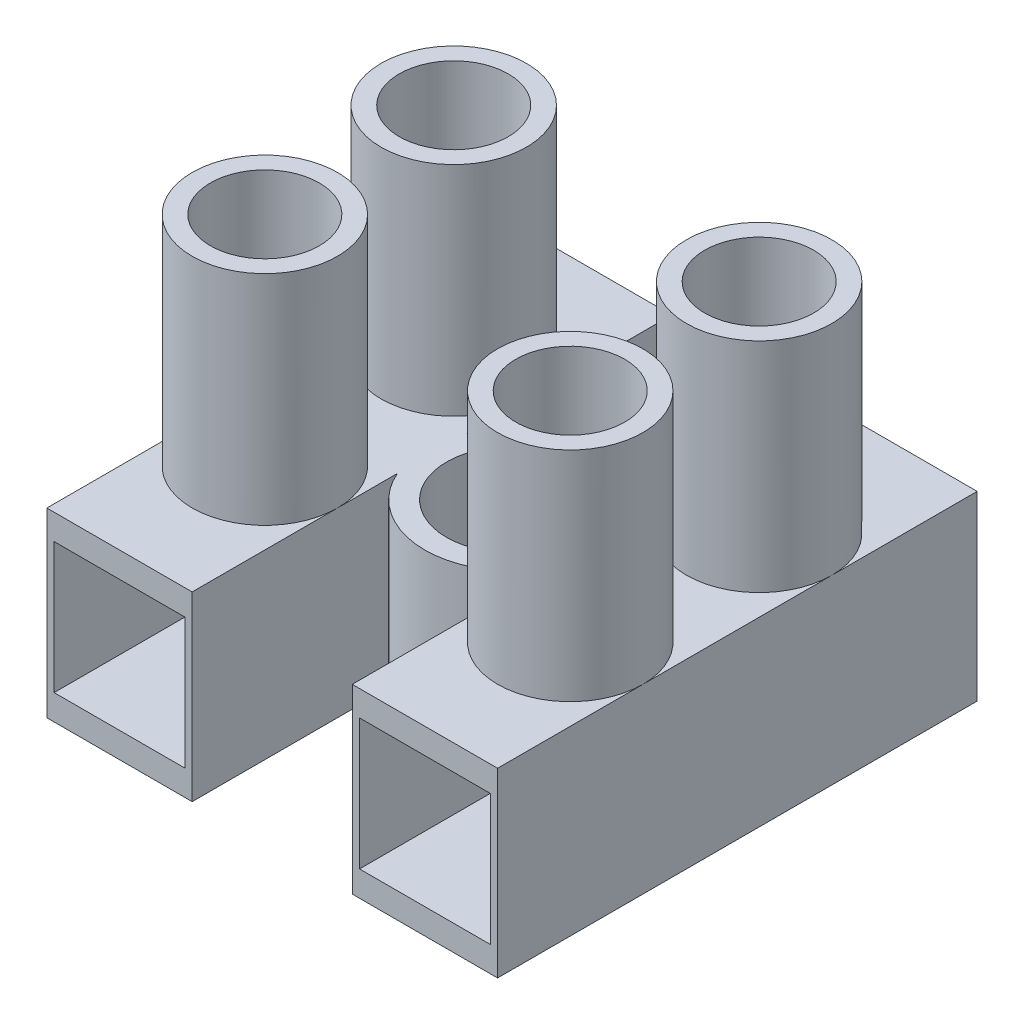
from build123d import *

# Parameters (mm, degrees)
BOSS_EXTRUDE1_DEPTH = 6.35
SKETCH2_R           = 2.286
CUT_EXTRUDE1_DEPTH  = 14.139417841
SKETCH3_W           = 4.572
SKETCH3_H           = 4.572
CUT_EXTRUDE2_DEPTH  = 7.62
SKETCH4_W           = 4.572
SKETCH4_H           = 4.572
CUT_EXTRUDE3_DEPTH  = 7.62
SKETCH5_R           = 2.54
SKETCH5_R_2         = 1.905
BOSS_EXTRUDE2_DEPTH = 7.62


with BuildPart() as part:
    # Sketch1 → Boss-Extrude1 (new body)
    with BuildSketch(Plane(origin=(0, 0, 0), x_dir=(1, 0, 0), z_dir=(0, 1, 0))):
        with BuildLine():
            Line((-2.798063036, -1.208779237), (-2.798063036, -8.382))
            Line((-2.798063036, -8.382), (-7.878063036, -8.382))
            Line((-7.878063036, -8.382), (-7.878063036, 8.382))
            Line((-7.878063036, 8.382), (-2.798063036, 8.382))
            Line((-2.798063036, 8.382), (-2.798063036, 1.208779237))
            ThreePointArc((-2.798063036, 1.208779237), (0, 3.048), (2.798063036, 1.208779237))
            Line((2.798063036, 1.208779237), (2.798063036, 8.382))
            Line((2.798063036, 8.382), (7.878063036, 8.382))
            Line((7.878063036, 8.382), (7.878063036, -8.382))
            Line((7.878063036, -8.382), (2.798063036, -8.382))
            Line((2.798063036, -8.382), (2.798063036, -1.208779237))
            ThreePointArc((2.798063036, -1.208779237), (0, -3.048), (-2.798063036, -1.208779237))
        make_face()
    extrude(amount=-BOSS_EXTRUDE1_DEPTH)

    # Sketch2 → Cut-Extrude1 (cut, through all)
    with BuildSketch(Plane(origin=(0, 0, 0), x_dir=(1, 0, 0), z_dir=(0, 1, 0))):
        with Locations(Location((0, 0, 0), (0, 0, 270))):
            Circle(SKETCH2_R)
    extrude(amount=-CUT_EXTRUDE1_DEPTH, mode=Mode.SUBTRACT)

    # Sketch3 → Cut-Extrude2 (cut)
    with BuildSketch(Plane.XY.offset(8.382)):
        with Locations((-5.338063036, -3.175)):
            Rectangle(SKETCH3_W, SKETCH3_H)
        with Locations((5.338063036, -3.175)):
            Rectangle(SKETCH3_W, SKETCH3_H)
    extrude(amount=-CUT_EXTRUDE2_DEPTH, mode=Mode.SUBTRACT)

    # Sketch4 → Cut-Extrude3 (cut)
    with BuildSketch(Plane(origin=(0, 0, -8.382), x_dir=(-1, 0, 0), z_dir=(0, 0, -1))):
        with Locations((-5.338063036, -3.175)):
            Rectangle(SKETCH4_W, SKETCH4_H)
        with Locations((5.338063036, -3.175)):
            Rectangle(SKETCH4_W, SKETCH4_H)
    extrude(amount=-CUT_EXTRUDE3_DEPTH, mode=Mode.SUBTRACT)

    # Sketch5 → Boss-Extrude2 (add)
    # profile 1 of 4: a face of its own
    with BuildSketch(Plane(origin=(0, 0, 0), x_dir=(1, 0, 0), z_dir=(0, 1, 0))):
        with Locations(Location((-5.338063036, -3.302, 0), (0, 0, 180))):
            Circle(SKETCH5_R)
        with Locations(Location((-5.338063036, -3.302, 0), (0, 0, 90))):
            Circle(SKETCH5_R_2, mode=Mode.SUBTRACT)
    # profile 2 of 4: a face of its own
    with BuildSketch(Plane(origin=(0, 0, 0), x_dir=(1, 0, 0), z_dir=(0, 1, 0))):
        with Locations(Location((-5.338063036, 3.302, 0), (0, 0, 180))):
            Circle(SKETCH5_R)
        with Locations(Location((-5.338063036, 3.302, 0), (0, 0, 90))):
            Circle(SKETCH5_R_2, mode=Mode.SUBTRACT)
    # profile 3 of 4: a face of its own
    with BuildSketch(Plane(origin=(0, 0, 0), x_dir=(1, 0, 0), z_dir=(0, 1, 0))):
        with Locations(Location((5.338063036, 3.302, 0), (0, 0, 180))):
            Circle(SKETCH5_R)
        with Locations(Location((5.338063036, 3.302, 0), (0, 0, 90))):
            Circle(SKETCH5_R_2, mode=Mode.SUBTRACT)
    # profile 4 of 4: a face of its own
    with BuildSketch(Plane(origin=(0, 0, 0), x_dir=(1, 0, 0), z_dir=(0, 1, 0))):
        with Locations(Location((5.338063036, -3.302, 0), (0, 0, 180))):
            Circle(SKETCH5_R)
        with Locations(Location((5.338063036, -3.302, 0), (0, 0, 90))):
            Circle(SKETCH5_R_2, mode=Mode.SUBTRACT)
    extrude(amount=BOSS_EXTRUDE2_DEPTH)


solid = part.part
